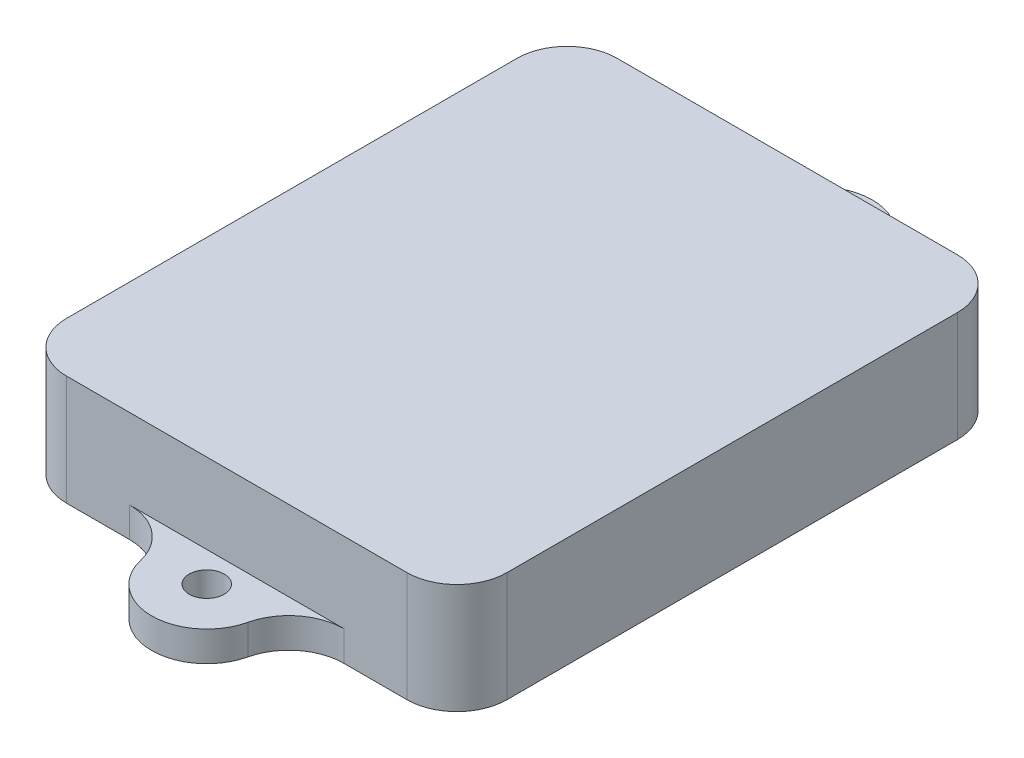
from build123d import *

# Parameters (mm, degrees)
SKETCH1_R           = 1.75
BOSS_EXTRUDE1_DEPTH = 11
SKETCH2_W           = 27.712142642
SKETCH2_H           = 8.5
CUT_EXTRUDE1_DEPTH  = 8


with BuildPart() as part:
    # Sketch1 → Boss-Extrude1 (new body)
    with BuildSketch(Plane(origin=(0, 0, 0), x_dir=(1, 0, 0), z_dir=(0, 1, 0))):
        with BuildLine():
            Line((17, -27.5), (10.712142643, -27.5))
            ThreePointArc((10.712142643, -27.5), (7.29344406, -28.691578015), (5.356071321, -31.75))
            ThreePointArc((5.356071321, -31.75), (0, -36), (-5.356071321, -31.75))
            ThreePointArc((-5.356071321, -31.75), (-7.29344406, -28.691578015), (-10.712142643, -27.5))
            Line((-10.712142643, -27.5), (-17, -27.5))
            ThreePointArc((-17, -27.5), (-20.535533906, -26.035533906), (-22, -22.5))
            Line((-22, -22.5), (-22, 22.5))
            ThreePointArc((-22, 22.5), (-20.535533906, 26.035533906), (-17, 27.5))
            Line((-17, 27.5), (-10.712142643, 27.5))
            ThreePointArc((-10.712142643, 27.5), (-7.29344406, 28.691578015), (-5.356071321, 31.75))
            ThreePointArc((-5.356071321, 31.75), (0, 36), (5.356071321, 31.75))
            ThreePointArc((5.356071321, 31.75), (7.29344406, 28.691578015), (10.712142643, 27.5))
            Line((10.712142643, 27.5), (17, 27.5))
            ThreePointArc((17, 27.5), (20.535533906, 26.035533906), (22, 22.5))
            Line((22, 22.5), (22, -22.5))
            ThreePointArc((22, -22.5), (20.535533906, -26.035533906), (17, -27.5))
        make_face()
        with Locations(Location((0, -30.5, 0), (0, 0, 270))):
            Circle(SKETCH1_R, mode=Mode.SUBTRACT)
        with Locations(Location((0, 30.5, 0), (0, 0, 270))):
            Circle(SKETCH1_R, mode=Mode.SUBTRACT)
    extrude(amount=BOSS_EXTRUDE1_DEPTH)

    # Sketch2 → Cut-Extrude1 (cut)
    with BuildSketch(Plane(origin=(0, 11, 0), x_dir=(1, 0, 0), z_dir=(0, 1, 0))):
        with Locations((0, -31.75)):
            Rectangle(SKETCH2_W, SKETCH2_H)
        with Locations((0, 31.75)):
            Rectangle(SKETCH2_W, SKETCH2_H)
    extrude(amount=-CUT_EXTRUDE1_DEPTH, mode=Mode.SUBTRACT)


solid = part.part
